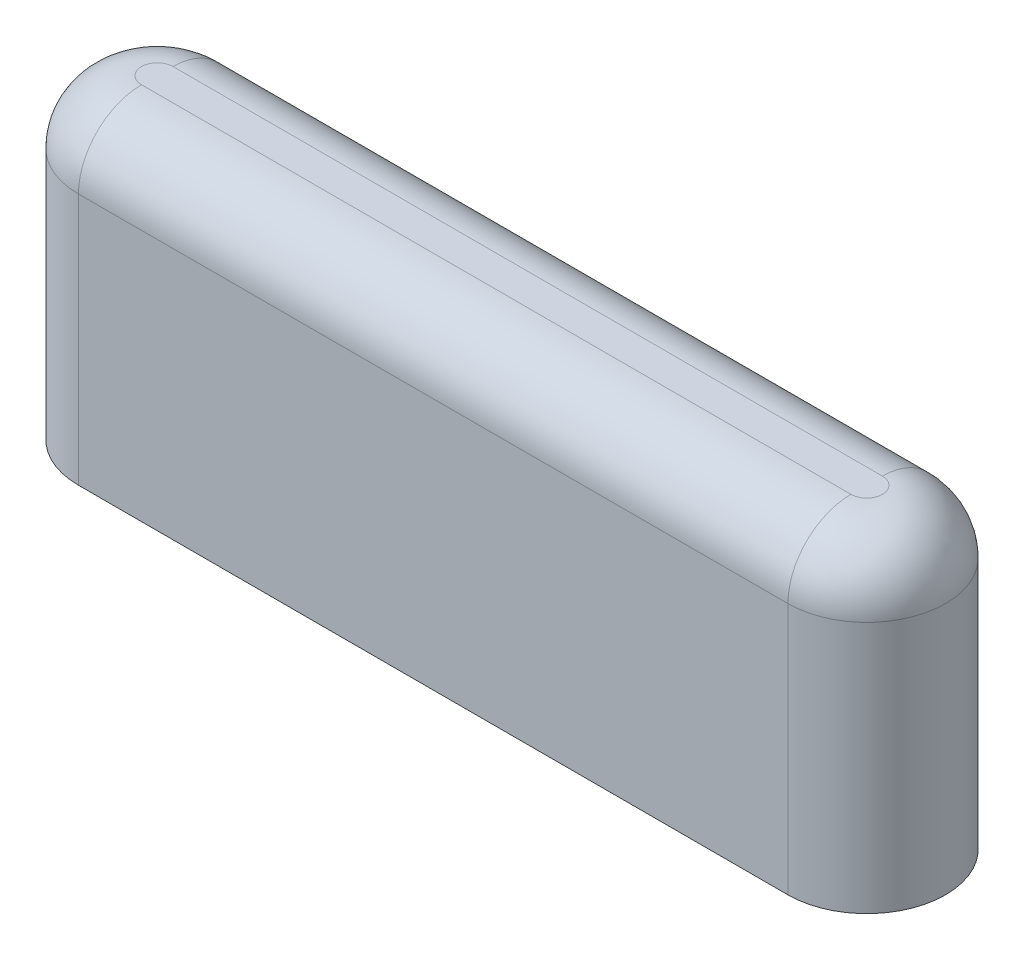
from build123d import *

# Parameters (mm, degrees)
BOSS_EXTRUDE1_DEPTH = 20
FILLET1_R           = 4
SKETCH2_R           = 2.75
CUT_EXTRUDE1_DEPTH  = 1.5
LPATTERN1_COUNT     = 2
LPATTERN1_PITCH     = 30


with BuildPart() as part:
    # Sketch1 → Boss-Extrude1 (new body)
    with BuildSketch(Plane(origin=(0, 0, 0), x_dir=(1, 0, 0), z_dir=(0, 1, 0))):
        with BuildLine():
            Line((22.5, -5), (-22.5, -5))
            ThreePointArc((-22.5, -5), (-27.5, 0), (-22.5, 5))
            Line((-22.5, 5), (22.5, 5))
            ThreePointArc((22.5, 5), (27.5, 0), (22.5, -5))
        make_face()
    extrude(amount=BOSS_EXTRUDE1_DEPTH)

    # Fillet1
    fillet1_edges = [part.edges().sort_by_distance(p)[0] for p in [
        (-27.5, 20, 0),
        (0, 20, 5),
        (27.5, 20, 0),
        (0, 20, -5),
    ]]
    fillet(fillet1_edges, radius=FILLET1_R)

    # Sketch2 → Cut-Extrude1 (cut)
    with BuildSketch(Plane.XZ):
        with Locations(Location((-22.5, 0, 0), (0, 0, 270))):
            Circle(SKETCH2_R)
    cut_extrude1 = extrude(amount=-CUT_EXTRUDE1_DEPTH, mode=Mode.SUBTRACT)

    # LPattern1: Cut-Extrude1 ×2
    with Locations(*[(i * LPATTERN1_PITCH, 0, 0) for i in range(1, LPATTERN1_COUNT)]):
        add(cut_extrude1, mode=Mode.SUBTRACT)


solid = part.part
